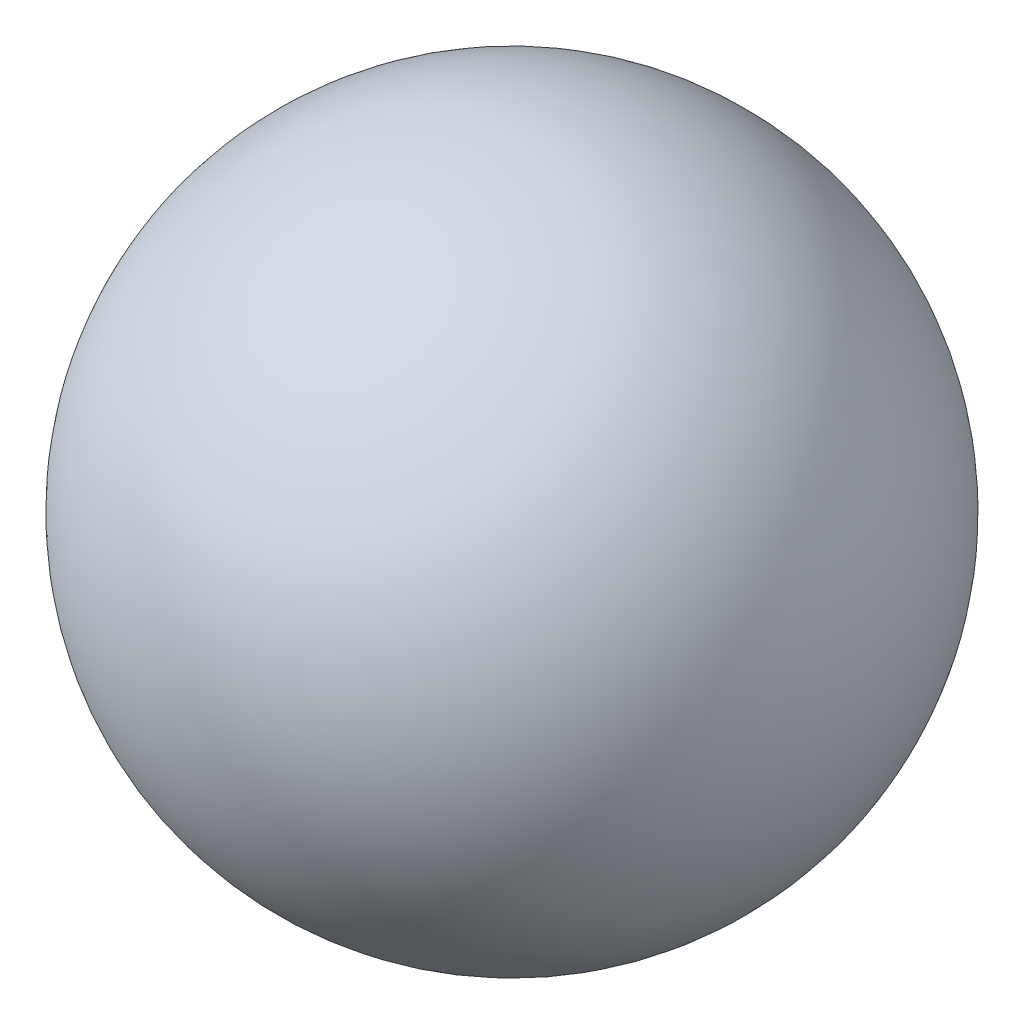
from build123d import *

# Parameters (mm, degrees)
SCALE1_SCALE = 0.1


with BuildPart() as part:
    # Sketch1 → Revolve1 (revolve)
    with BuildSketch(Plane.XY):
        with BuildLine():
            Line((-8, 0), (8, 0))
            ThreePointArc((8, 0), (0, -8), (-8, 0))
        make_face()
    revolve(axis=Axis((-8, 0, 0), (1, 0, 0)))


with BuildPart() as part_1:
    # Scale1: scaled about (0, 0, 0)
    add(part.part.scale(SCALE1_SCALE))


solid = part_1.part
